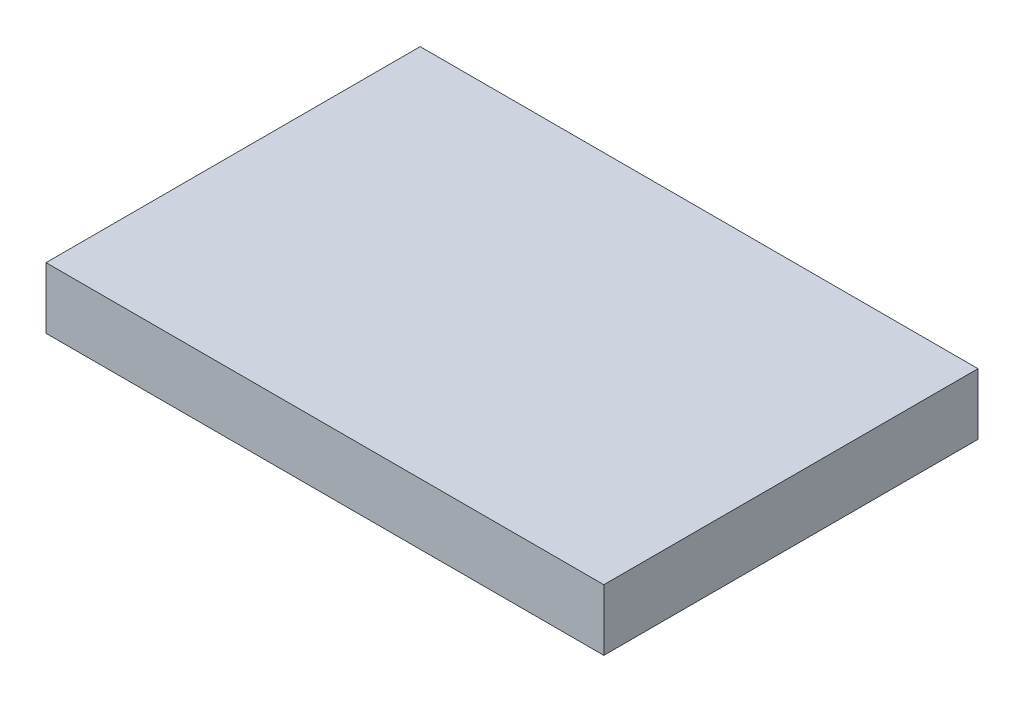
from build123d import *

# Parameters (mm, degrees)
SKETCH1_W           = 82
SKETCH1_H           = 55
BOSS_EXTRUDE1_DEPTH = 9


with BuildPart() as part:
    # Sketch1 → Boss-Extrude1 (new body)
    with BuildSketch(Plane(origin=(0, 0, 0), x_dir=(1, 0, 0), z_dir=(0, 1, 0))):
        Rectangle(SKETCH1_W, SKETCH1_H)
    extrude(amount=BOSS_EXTRUDE1_DEPTH)


solid = part.part
